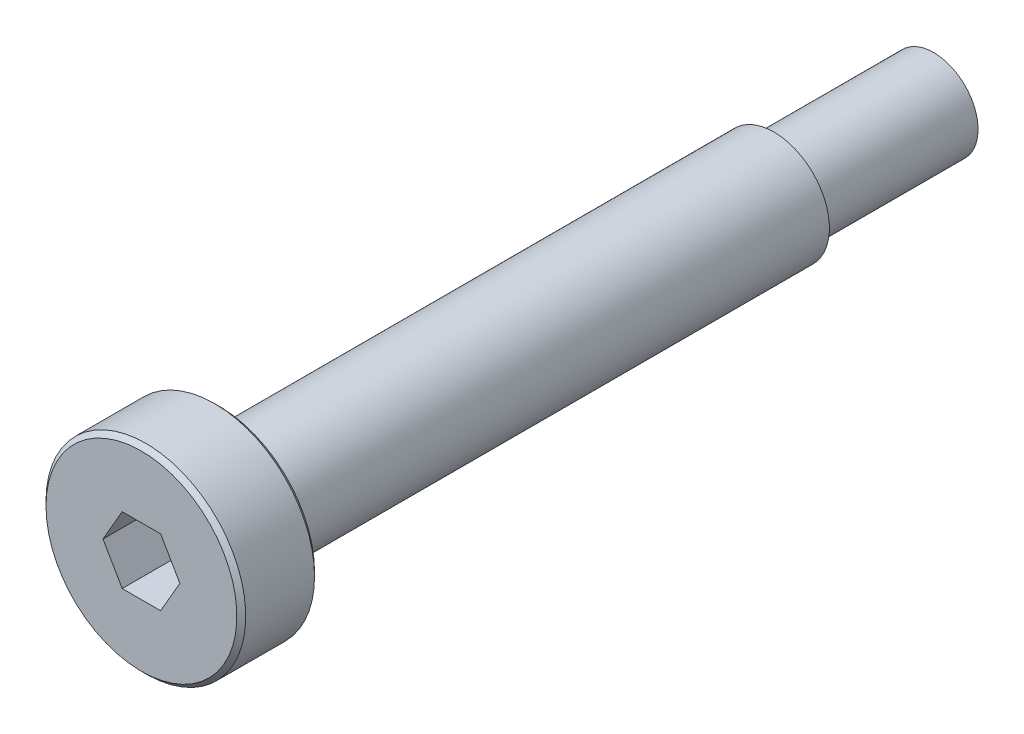
from build123d import *

# Parameters (mm, degrees)
CUT_EXTRUDE_1_DEPTH = 3
CHAMFER_1_SIZE      = 0.2


with BuildPart() as part:
    # 草图1 → 旋转1 (revolve)
    with BuildSketch(Plane.YZ, mode=Mode.PRIVATE) as revolve_1_sk:
        Polygon((0, 0), (-4.5, 0), (-4.5, -3.5), (-2.5, -3.5), (-2.5, -28.5), (-2, -28.5), (-2, -35.7), (0, -35.7), align=None)
    revolve(revolve_1_sk.sketch.rotate(Axis((0, 0, -35.7), (0, 0, 1)), 270), axis=Axis((0, 0, -35.7), (0, 0, 1)))

    # 草图2 → 切除-拉伸1 (cut)
    with BuildSketch(Plane.XY):
        Polygon((1.732050808, 0), (0.866025404, 1.5), (-0.866025404, 1.5), (-1.732050808, 0), (-0.866025404, -1.5), (0.866025404, -1.5), align=None)
    extrude(amount=-CUT_EXTRUDE_1_DEPTH, mode=Mode.SUBTRACT)

    # 倒角1
    chamfer_1_edges = [part.edges().sort_by_distance(p)[0] for p in [
        (4.5, 0, -3.5),
        (4.5, 0, 0),
    ]]
    chamfer(chamfer_1_edges, length=CHAMFER_1_SIZE)


solid = part.part
